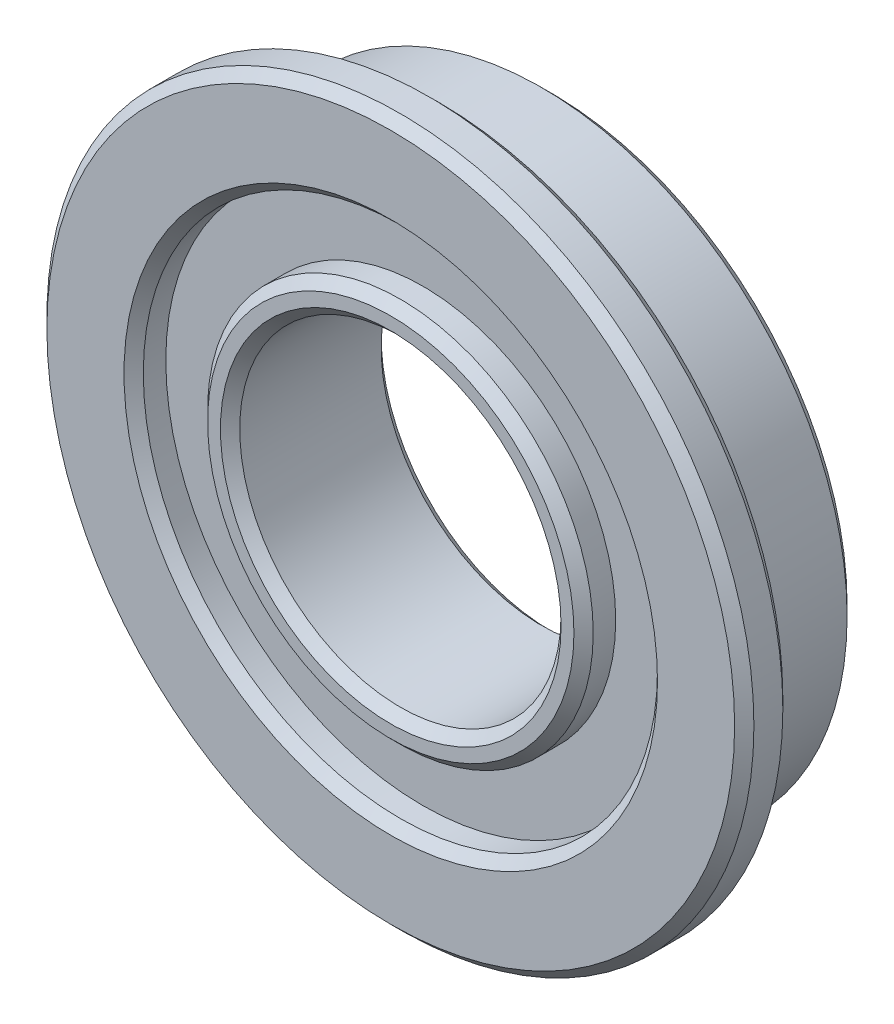
from build123d import *

# Parameters (mm, degrees)
SKETCH_1_R          = 9.5
SKETCH_1_R_2        = 5
EXTRUDE_1_DEPTH     = 5
EXTRUDE_START       = -1.5
SKETCH_2_R          = 11
SKETCH_2_R_2        = 9.5
EXTRUDE_2_DEPTH     = 1.5
SKETCH_3_R          = 8
SKETCH_3_R_2        = 6
CUT_EXTRUDE_1_DEPTH = 1
CUT_EXTRUDE_START   = -1
SKETCH_4_R          = 8
SKETCH_4_R_2        = 6
CUT_EXTRUDE_2_DEPTH = 1
CHAMFER_1_SIZE      = 0.3


with BuildPart() as part:
    # Эскиз1 → Бобышка-Вытянуть1 (new body)
    with BuildSketch(Plane.XY):
        Circle(SKETCH_1_R)
        Circle(SKETCH_1_R_2, mode=Mode.SUBTRACT)
    extrude(amount=EXTRUDE_1_DEPTH)

    # Эскиз2 → Бобышка-Вытянуть2 (add)
    with BuildSketch(Plane.XY.offset(5).offset(EXTRUDE_START)):
        Circle(SKETCH_2_R)
        Circle(SKETCH_2_R_2, mode=Mode.SUBTRACT)
    extrude(amount=EXTRUDE_2_DEPTH)

    # Эскиз3 → Вырез-Вытянуть1 (cut)
    with BuildSketch(Plane(origin=(0, 0, 0), x_dir=(-1, 0, 0), z_dir=(0, 0, -1))):
        Circle(SKETCH_3_R)
        Circle(SKETCH_3_R_2, mode=Mode.SUBTRACT)
    extrude(amount=-CUT_EXTRUDE_1_DEPTH, mode=Mode.SUBTRACT)

    # Эскиз4 → Вырез-Вытянуть2 (cut)
    with BuildSketch(Plane.XY.offset(5).offset(CUT_EXTRUDE_START)):
        with Locations(Location((0, 0, 0), (0, 0, 180))):
            Circle(SKETCH_4_R)
        with Locations(Location((0, 0, 0), (0, 0, 180))):
            Circle(SKETCH_4_R_2, mode=Mode.SUBTRACT)
    extrude(amount=CUT_EXTRUDE_2_DEPTH, mode=Mode.SUBTRACT)

    # Фаска1
    chamfer_1_edges = [part.edges().sort_by_distance(p)[0] for p in [
        (-11, 0, 3.5),
        (-11, 0, 5),
        (8, 0, 0),
        (6, 0, 0),
        (-9.5, 0, 0),
        (8, 0, 5),
        (6, 0, 5),
        (-5, 0, 0),
        (-5, 0, 5),
    ]]
    chamfer(chamfer_1_edges, length=CHAMFER_1_SIZE)


solid = part.part
